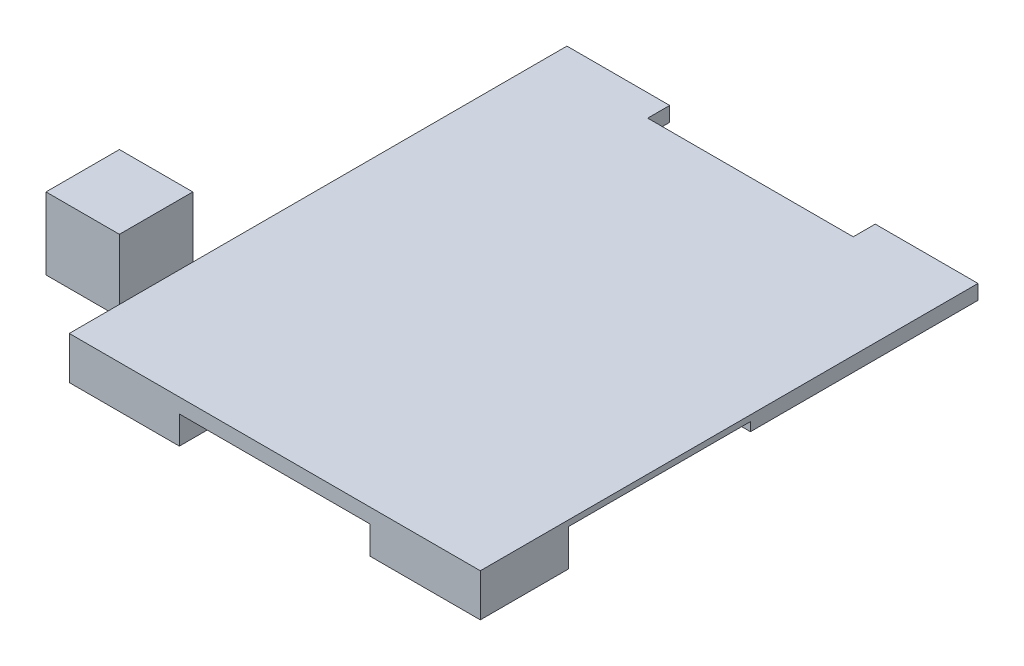
from build123d import *

# Parameters (mm, degrees)
BOSS_EXTRUDE1_DEPTH      = 0.6
BOSS_EXTRUDE3_DEPTH      = 0.4
BOSS_EXTRUDE3_DEPTH_BACK = 4.5
SKETCH3_W                = 5
SKETCH3_H                = 5
BOSS_EXTRUDE5_DEPTH      = 0.4
BOSS_EXTRUDE6_DEPTH      = 2.5


with BuildPart() as part:
    # Sketch1 → Boss-Extrude1 (new body)
    with BuildSketch(Plane(origin=(0, 0, 0), x_dir=(1, 0, 0), z_dir=(0, 1, 0))):
        with BuildLine():
            Line((-4.887739764, -8.146164742), (-4.887739764, -8.2))
            Line((-4.887739764, -8.2), (-14, -8.2))
            Line((-14, -8.2), (-14, -10.2))
            Line((-14, -10.2), (14, -10.2))
            Line((14, -10.2), (14, -8.2))
            Line((14, -8.2), (4.887739764, -8.2))
            Line((4.887739764, -8.2), (4.887739764, -8.146164742))
            ThreePointArc((4.887739764, -8.146164742), (7.572366309, -5.736660046), (9.16515139, -2.5))
            Line((9.16515139, -2.5), (7, -2.5))
            Line((7, -2.5), (7, 2.5))
            Line((7, 2.5), (9.16515139, 2.5))
            ThreePointArc((9.16515139, 2.5), (7.572366309, 5.736660046), (4.887739764, 8.146164742))
            Line((4.887739764, 8.146164742), (4.887739764, 8.2))
            Line((4.887739764, 8.2), (14, 8.2))
            Line((14, 8.2), (14, 11.2))
            Line((14, 11.2), (14, 21.7))
            Line((14, 21.7), (14, 23.7))
            Line((14, 23.7), (7, 23.7))
            Line((7, 23.7), (7, 22.2))
            Line((7, 22.2), (-7, 22.2))
            Line((-7, 22.2), (-7, 23.7))
            Line((-7, 23.7), (-14, 23.7))
            Line((-14, 23.7), (-14, 23.208379168))
            Line((-14, 23.208379168), (-14, 11.208379168))
            Line((-14, 11.208379168), (-14, 8.2))
            Line((-14, 8.2), (-4.887739764, 8.2))
            Line((-4.887739764, 8.2), (-4.887739764, 8.146164742))
            ThreePointArc((-4.887739764, 8.146164742), (-9.5, 0), (-4.887739764, -8.146164742))
        make_face()
    extrude(amount=-BOSS_EXTRUDE1_DEPTH)

    # Sketch4 → Boss-Extrude5 (add)
    with BuildSketch(Plane(origin=(0, 0, 0), x_dir=(1, 0, 0), z_dir=(0, 1, 0))):
        Polygon((-14, 23.7), (-7, 23.7), (-7, 22.2), (7, 22.2), (7, 23.7), (14, 23.7), (14, 22.2), (14, -10.2), (-14, -10.2), (-14, 22.2), align=None)
    extrude(amount=BOSS_EXTRUDE5_DEPTH)

    # Sketch5 → Boss-Extrude6 (add)
    with BuildSketch(Plane(origin=(0, 0, 0), x_dir=(1, 0, 0), z_dir=(0, 1, 0))):
        Polygon((-11, -8.2), (-11, -4.2), (-14, -4.2), (-14, -10.2), (-9.887739764, -10.2), (-6.5, -10.2), (-6.5, -8.2), align=None)
        Polygon((9.887739764, -10.2), (6.5, -10.2), (6.5, -8.2), (11, -8.2), (11, -4.2), (14, -4.2), (14, -10.2), align=None)
    extrude(amount=-BOSS_EXTRUDE6_DEPTH)


with BuildPart() as body_2:
    # Sketch3 → Boss-Extrude3 (new, two sides: drawn at the far end of the back side and taken through both)
    with BuildSketch(Plane(origin=(0, 0, 0), x_dir=(1, 0, 0), z_dir=(0, 1, 0)).offset(-BOSS_EXTRUDE3_DEPTH_BACK)):
        with Locations((-20.640136174, -0.144063269)):
            Rectangle(SKETCH3_W, SKETCH3_H)
    extrude(amount=BOSS_EXTRUDE3_DEPTH + BOSS_EXTRUDE3_DEPTH_BACK)


solid = Compound([part.part, body_2.part])
